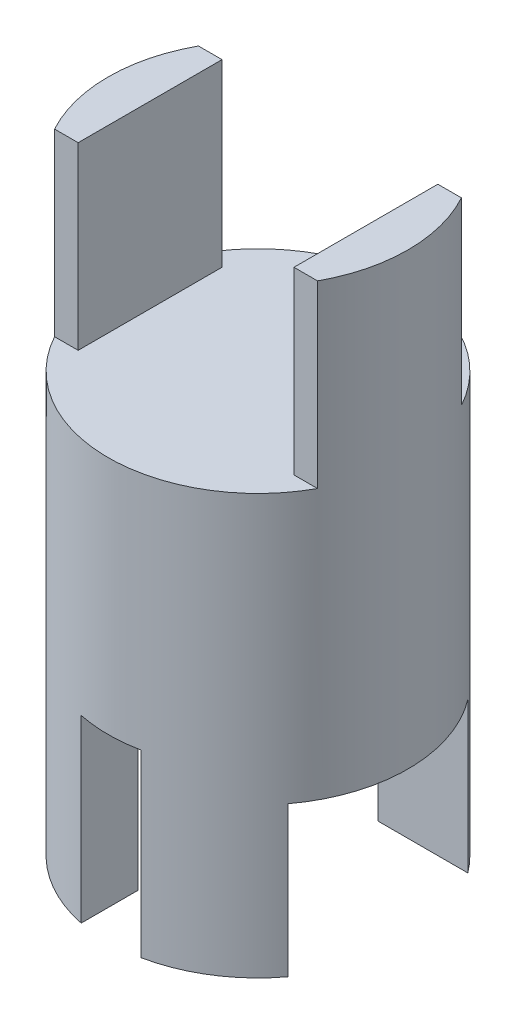
from build123d import *

# Parameters (mm, degrees)
SKETCH1_R               = 25
BOSS_EXTRUDE1_DEPTH     = 25
BOSS_EXTRUDE2_START     = 75
SKETCH1_2_R             = 25
BOSS_EXTRUDE2_DEPTH     = 75
CUT_EXTRUDE1_DEPTH      = 83.915619759
CUT_EXTRUDE1_DEPTH_BACK = 83.915619759
SKETCH2_W               = 25
SKETCH2_H               = 30
CUT_EXTRUDE2_DEPTH      = 83.915619759
CUT_EXTRUDE2_DEPTH_BACK = 83.915619759
SKETCH5_W               = 30
SKETCH5_H               = 13
CUT_EXTRUDE3_DEPTH      = 83.915619759
CUT_EXTRUDE3_DEPTH_BACK = 83.915619759
SKETCH6_W               = 30
SKETCH6_H               = 10
CUT_EXTRUDE4_DEPTH      = 83.915619759
CUT_EXTRUDE4_DEPTH_BACK = 83.915619759
SKETCH8_W               = 30
SKETCH8_H               = 36


with BuildPart() as part:
    # Sketch1 → Boss-Extrude1 (new body)
    with BuildSketch(Plane(origin=(0, 0, 0), x_dir=(-1, 0, 0), z_dir=(0, 1, 0))):
        Circle(SKETCH1_R)
    extrude(amount=-BOSS_EXTRUDE1_DEPTH)

    # Sketch1<2> → Boss-Extrude2 (add)
    with BuildSketch(Plane(origin=(0, 0, 0), x_dir=(-1, 0, 0), z_dir=(0, 1, 0)).offset(BOSS_EXTRUDE2_START)):
        Circle(SKETCH1_2_R)
    extrude(amount=-BOSS_EXTRUDE2_DEPTH)

    # Sketch2 → Cut-Extrude1 (cut, two sides: drawn at the far end of the back side and taken through both)
    with BuildSketch(Plane.YZ.offset(-CUT_EXTRUDE1_DEPTH_BACK)):
        with Locations((-12.5, 0)):
            Rectangle(SKETCH2_W, SKETCH2_H)
    extrude(amount=CUT_EXTRUDE1_DEPTH + CUT_EXTRUDE1_DEPTH_BACK, mode=Mode.SUBTRACT)

    # Sketch5 → Cut-Extrude2 (cut, two sides: drawn at the far end of the back side and taken through both)
    with BuildSketch(Plane.YZ.offset(-CUT_EXTRUDE2_DEPTH_BACK)):
        with Locations((60, 18.5)):
            Rectangle(SKETCH5_W, SKETCH5_H)
        with Locations((60, -18.5)):
            Rectangle(SKETCH5_W, SKETCH5_H)
    extrude(amount=CUT_EXTRUDE2_DEPTH + CUT_EXTRUDE2_DEPTH_BACK, mode=Mode.SUBTRACT)

    # Sketch6 → Cut-Extrude3 (cut, two sides: drawn at the far end of the back side and taken through both)
    with BuildSketch(Plane(origin=(0, 0, 0), x_dir=(0, 1, 0), z_dir=(0, 0, 1)).offset(-CUT_EXTRUDE3_DEPTH_BACK)):
        with Locations((-10, 0)):
            Rectangle(SKETCH6_W, SKETCH6_H)
    extrude(amount=CUT_EXTRUDE3_DEPTH + CUT_EXTRUDE3_DEPTH_BACK, mode=Mode.SUBTRACT)

    # Sketch8 → Cut-Extrude4 (cut, two sides: drawn at the far end of the back side and taken through both)
    with BuildSketch(Plane(origin=(0, 0, 0), x_dir=(0, 1, 0), z_dir=(0, 0, 1)).offset(-CUT_EXTRUDE4_DEPTH_BACK)):
        with Locations((60, 0)):
            Rectangle(SKETCH8_W, SKETCH8_H)
    extrude(amount=CUT_EXTRUDE4_DEPTH + CUT_EXTRUDE4_DEPTH_BACK, mode=Mode.SUBTRACT)


solid = part.part
